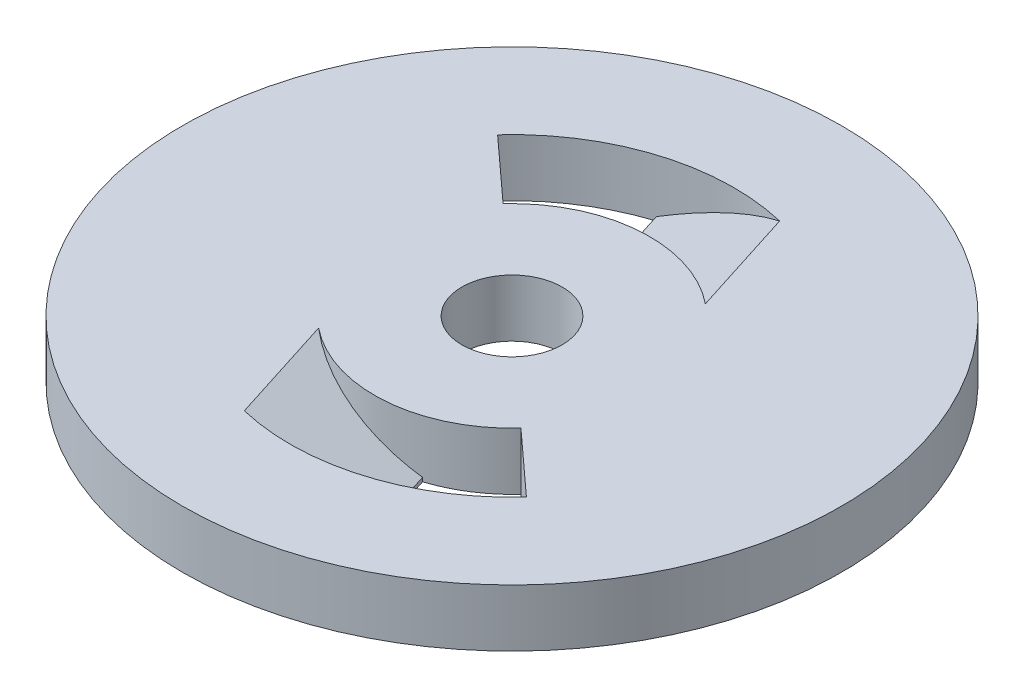
from build123d import *

# Parameters (mm, degrees)
SKETCH1_R           = 11.5
SKETCH1_R_2         = 1.75
BOSS_EXTRUDE1_DEPTH = 2
CUT_EXTRUDE1_DEPTH  = 2
CHAMFER1_SIZE       = 4
CHAMFER1_SIZE2      = 1.865230633
CHAMFER2_SIZE       = 4
CHAMFER2_SIZE2      = 1.865230633


with BuildPart() as part:
    # Sketch1 → Boss-Extrude1 (new body)
    with BuildSketch(Plane(origin=(0, 0, 0), x_dir=(1, 0, 0), z_dir=(0, 1, 0))):
        with Locations(Location((0, 0, 0), (0, 0, 270))):
            Circle(SKETCH1_R)
        with Locations(Location((0, 0, 0), (0, 0, 270))):
            Circle(SKETCH1_R_2, mode=Mode.SUBTRACT)
    extrude(amount=BOSS_EXTRUDE1_DEPTH)

    # Sketch2 → Cut-Extrude1 (cut)
    with BuildSketch(Plane(origin=(0, 2, 0), x_dir=(1, 0, 0), z_dir=(0, 1, 0))):
        with BuildLine():
            Line((-1.45362124, 4.5746022), (-2.346992627, 7.386076469))
            ThreePointArc((-2.346992627, 7.386076469), (-4.178678051, 6.526955626), (-5.725593472, 5.223033543))
            Line((-5.725593472, 5.223033543), (-3.546174021, 3.234911098))
            ThreePointArc((-3.546174021, 3.234911098), (-2.58808447, 4.042501549), (-1.45362124, 4.5746022))
        make_face()
        with BuildLine():
            Line((5.725593472, -5.223033543), (3.546174021, -3.234911098))
            ThreePointArc((3.546174021, -3.234911098), (2.58808447, -4.042501549), (1.45362124, -4.5746022))
            Line((1.45362124, -4.5746022), (2.346992627, -7.386076469))
            ThreePointArc((2.346992627, -7.386076469), (4.178678051, -6.526955626), (5.725593472, -5.223033543))
        make_face()
    extrude(amount=-CUT_EXTRUDE1_DEPTH, mode=Mode.SUBTRACT)

    # Chamfer1
    chamfer1_edges = [part.edges().sort_by_distance(p)[0] for p in [
        (-1.900306933, 2, -5.980339335),
    ]]
    chamfer1_side = [part.faces().sort_by_distance(p)[0] for p in [
        (0, 2, -11.174730881),
    ]]
    chamfer(chamfer1_edges, length=CHAMFER1_SIZE, length2=CHAMFER1_SIZE2, reference=chamfer1_side[0])

    # Chamfer2
    chamfer2_edges = [part.edges().sort_by_distance(p)[0] for p in [
        (1.900306933, 2, 5.980339335),
    ]]
    chamfer2_side = [part.faces().sort_by_distance(p)[0] for p in [
        (-0.343824977, 2, -4.461502083),
    ]]
    chamfer(chamfer2_edges, length=CHAMFER2_SIZE, length2=CHAMFER2_SIZE2, reference=chamfer2_side[0])


solid = part.part
